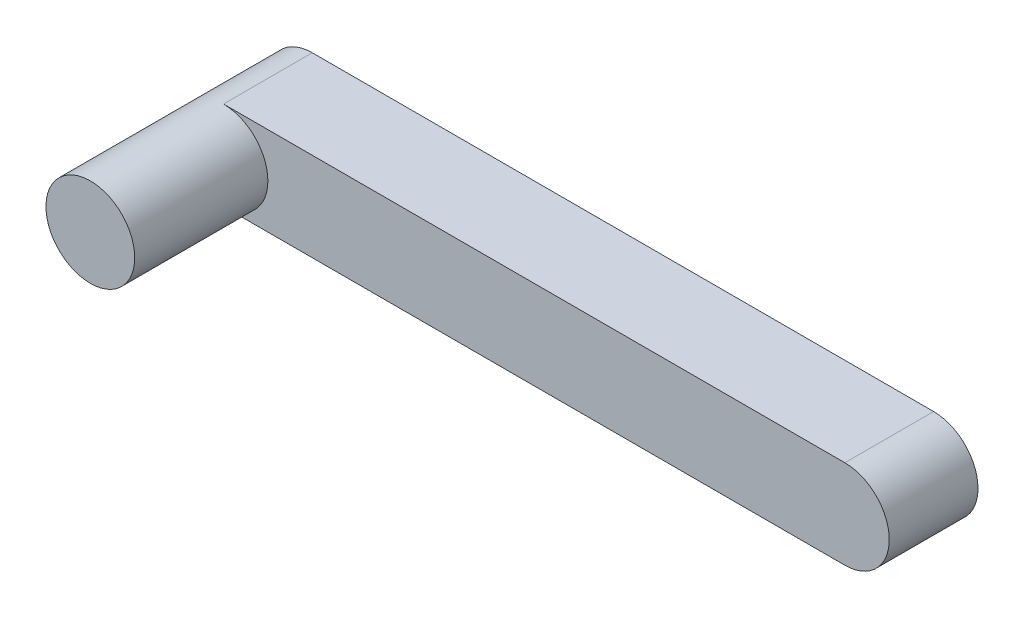
from build123d import *

# Parameters (mm, degrees)
BOSS_EXTRUDE1_DEPTH = 25.4
SKETCH2_R           = 12.7
BOSS_EXTRUDE2_DEPTH = 38.1


with BuildPart() as part:
    # Sketch1 → Boss-Extrude1 (new body)
    with BuildSketch(Plane.XY):
        with BuildLine():
            Line((0, -12.7), (-177.8, -12.7))
            ThreePointArc((-177.8, -12.7), (-190.5, 0), (-177.8, 12.7))
            Line((-177.8, 12.7), (0, 12.7))
            ThreePointArc((0, 12.7), (12.7, 0), (0, -12.7))
        make_face()
    extrude(amount=BOSS_EXTRUDE1_DEPTH)

    # Sketch2 → Boss-Extrude2 (add)
    with BuildSketch(Plane.XY.offset(25.4)):
        with Locations(Location((-177.8, 0, 0), (0, 0, 270))):
            Circle(SKETCH2_R)
    extrude(amount=BOSS_EXTRUDE2_DEPTH)


solid = part.part
